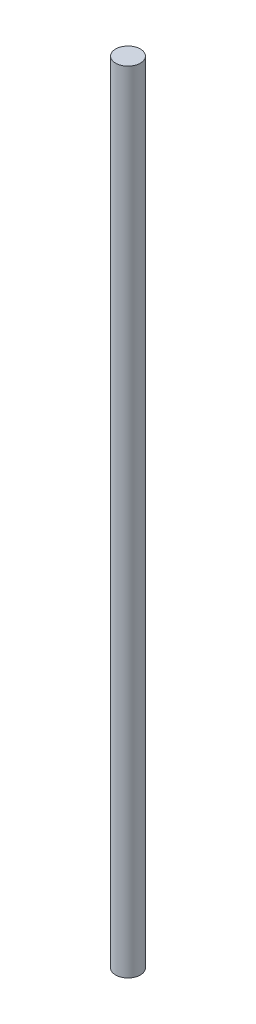
from build123d import *

# Parameters (mm, degrees)
SKETCH1_R           = 3.175
BOSS_EXTRUDE1_DEPTH = 203.2


with BuildPart() as part:
    # Sketch1 → Boss-Extrude1 (new body)
    with BuildSketch(Plane(origin=(0, 0, 0), x_dir=(1, 0, 0), z_dir=(0, 1, 0))):
        with Locations(Location((0, 0, 0), (0, 0, 270))):
            Circle(SKETCH1_R)
    extrude(amount=BOSS_EXTRUDE1_DEPTH)


solid = part.part
